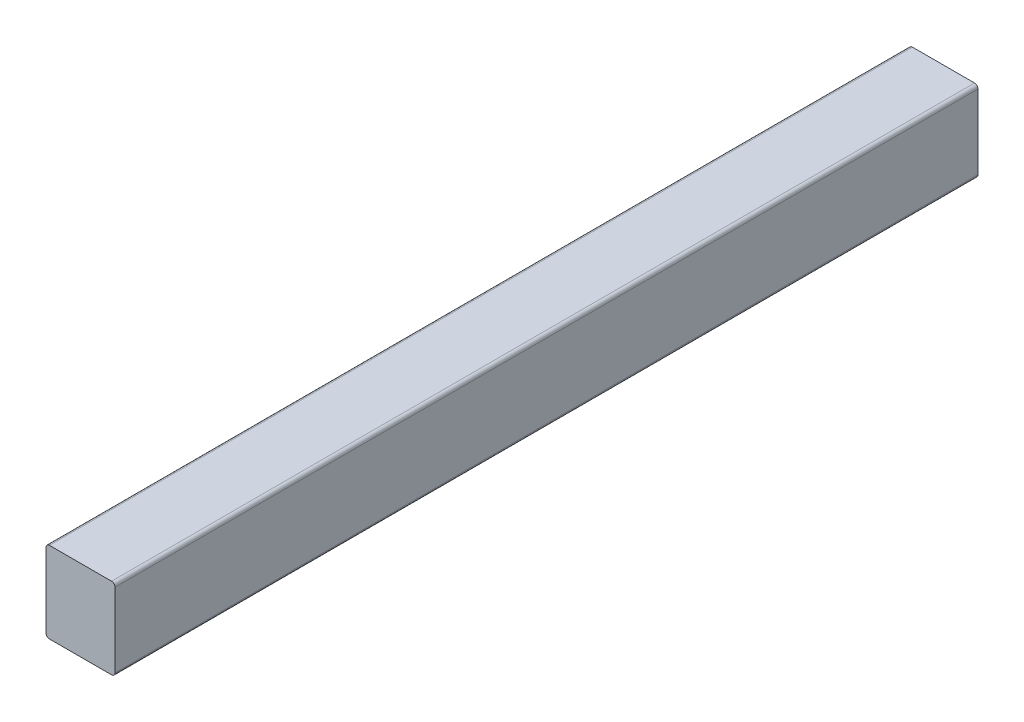
from build123d import *

# Parameters (mm, degrees)
SKETCH1_W           = 4
SKETCH1_H           = 4.7
BOSS_EXTRUDE1_DEPTH = 50
FILLET1_R           = 0.2


with BuildPart() as part:
    # Sketch1 → Boss-Extrude1 (new body)
    with BuildSketch(Plane.XY):
        Rectangle(SKETCH1_W, SKETCH1_H)
    extrude(amount=BOSS_EXTRUDE1_DEPTH)

    # Fillet1
    fillet1_edges = [part.edges().sort_by_distance(p)[0] for p in [
        (-2, 2.35, 25),
        (2, 2.35, 25),
        (2, -2.35, 25),
        (-2, -2.35, 25),
    ]]
    fillet(fillet1_edges, radius=FILLET1_R)


solid = part.part
